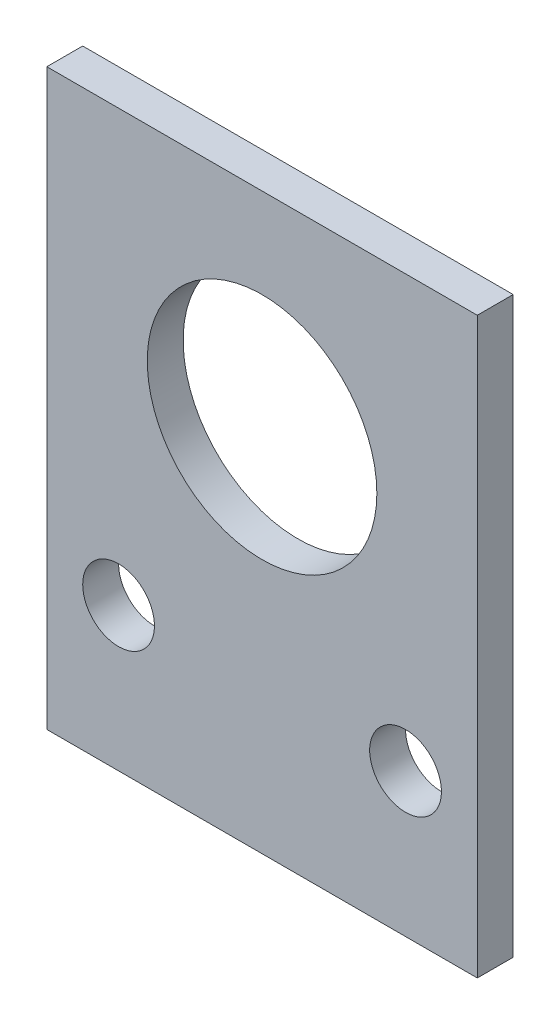
from build123d import *

# Parameters (mm, degrees)
SKETCH1_W           = 60
SKETCH1_H           = 80
SKETCH1_R           = 16
SKETCH1_R_2         = 5
BOSS_EXTRUDE1_DEPTH = 5


with BuildPart() as part:
    # Sketch1 → Boss-Extrude1 (new body)
    with BuildSketch(Plane.XY):
        Rectangle(SKETCH1_W, SKETCH1_H)
        with Locations((0, 11.5)):
            Circle(SKETCH1_R, mode=Mode.SUBTRACT)
        with Locations((20, -20)):
            Circle(SKETCH1_R_2, mode=Mode.SUBTRACT)
        with Locations(Location((-20, -20, 0), (0, 0, 180))):
            Circle(SKETCH1_R_2, mode=Mode.SUBTRACT)
    extrude(amount=BOSS_EXTRUDE1_DEPTH)


solid = part.part
